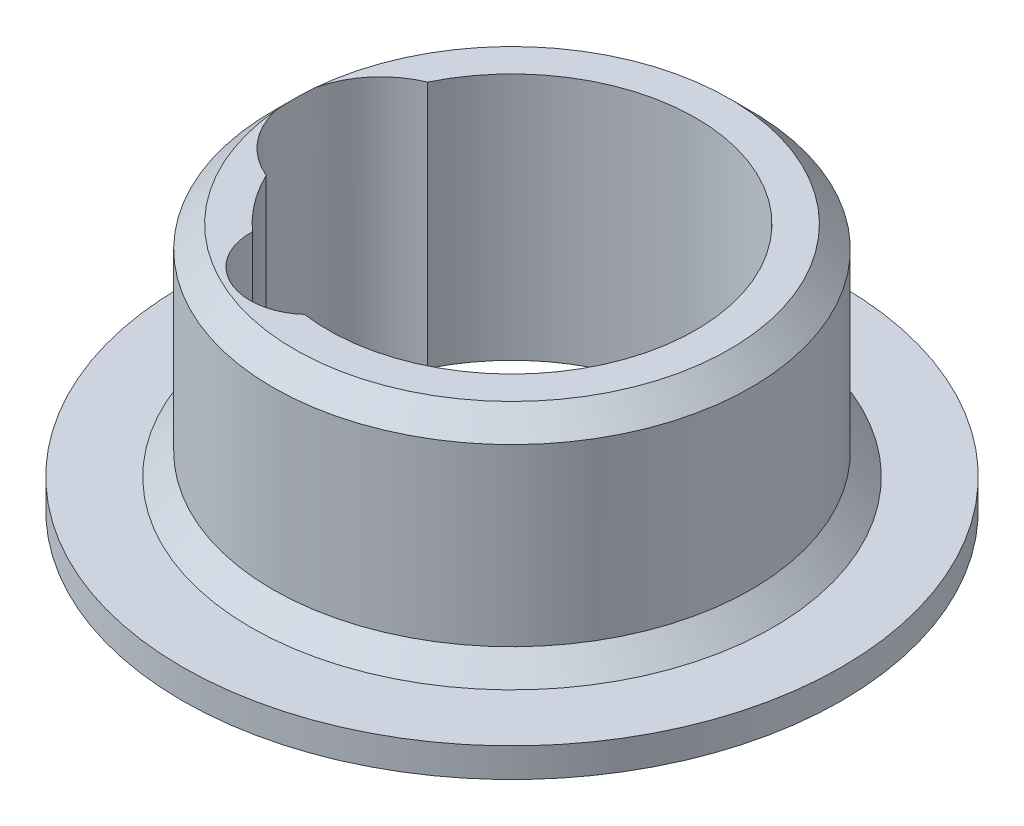
from build123d import *

# Parameters (mm, degrees)
ESBO_O1_R                = 22.6
ESBO_O1_R_2              = 12.6
RESSALTO_EXTRUS_O1_DEPTH = 2
ESBO_O2_R                = 16.4
ESBO_O2_R_2              = 12.6
RESSALTO_EXTRUS_O2_DEPTH = 15
CHANFRO2_SIZE            = 1.5
ESBO_O3_R                = 6
ESBO_O3_R_2              = 4
CORTE_EXTRUS_O1_DEPTH    = 37.201104956


with BuildPart() as part:
    # Esboço1 → Ressalto-extrusão1 (new body)
    with BuildSketch(Plane(origin=(0, 0, 0), x_dir=(1, 0, 0), z_dir=(0, 1, 0))):
        with Locations(Location((0, 0, 0), (0, 0, 270))):
            Circle(ESBO_O1_R)
        with Locations(Location((0, 0, 0), (0, 0, 270))):
            Circle(ESBO_O1_R_2, mode=Mode.SUBTRACT)
    extrude(amount=RESSALTO_EXTRUS_O1_DEPTH)

    # Esboço2 → Ressalto-extrusão2 (add)
    with BuildSketch(Plane(origin=(0, 2, 0), x_dir=(1, 0, 0), z_dir=(0, 1, 0))):
        with Locations(Location((0, 0, 0), (0, 0, 270))):
            Circle(ESBO_O2_R)
        with Locations(Location((0, 0, 0), (0, 0, 270))):
            Circle(ESBO_O2_R_2, mode=Mode.SUBTRACT)
    extrude(amount=RESSALTO_EXTRUS_O2_DEPTH)

    # Chanfro2
    chanfro2_edges = [part.edges().sort_by_distance(p)[0] for p in [
        (0, 17, -16.4),
        (0, 2, -16.4),
    ]]
    chamfer(chanfro2_edges, length=CHANFRO2_SIZE)

    # Esboço3 → Corte-extrusão1 (cut, through all)
    with BuildSketch(Plane(origin=(0, 0, 0), x_dir=(1, 0, 0), z_dir=(0, 1, 0))):
        with Locations((-9, 0)):
            Circle(ESBO_O3_R)
        with Locations((-4.437491748, -9.516231764)):
            Circle(ESBO_O3_R_2)
    extrude(amount=CORTE_EXTRUS_O1_DEPTH, mode=Mode.SUBTRACT)


solid = part.part
